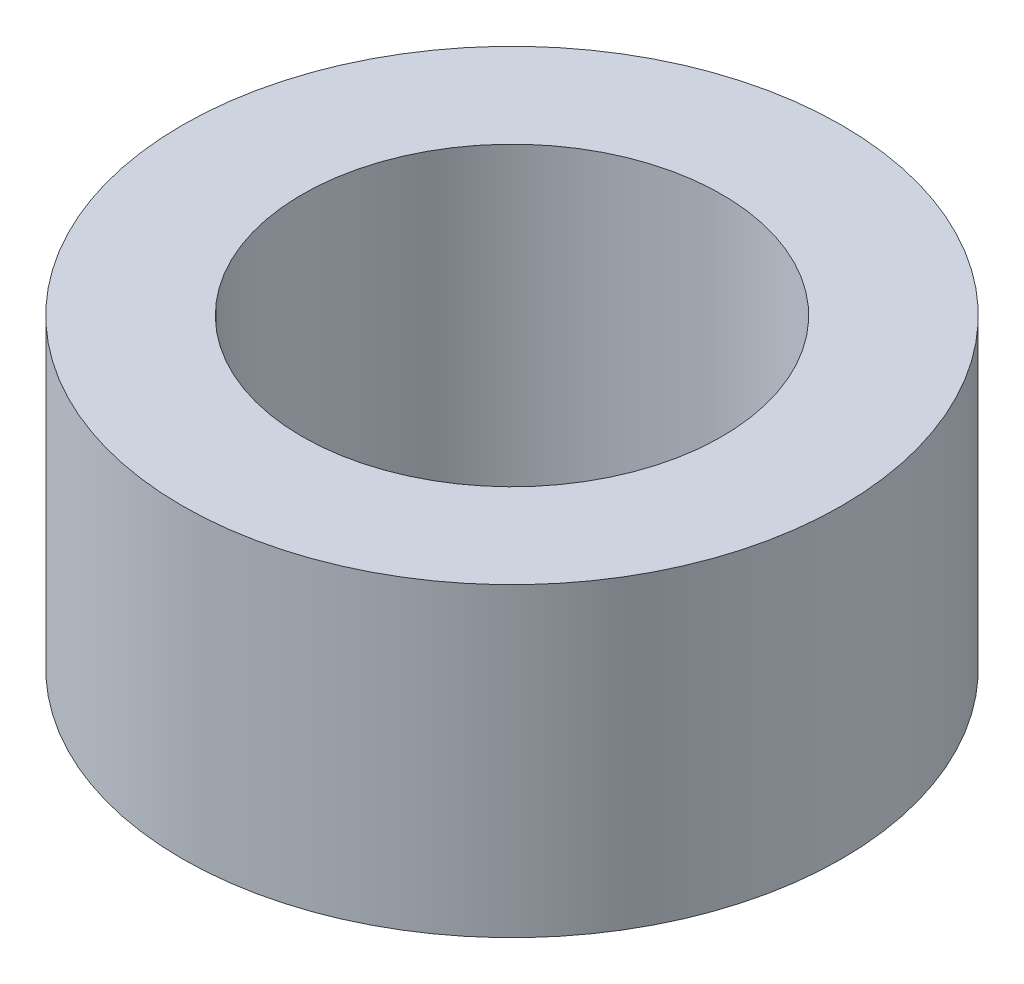
from build123d import *

# Parameters (mm, degrees)
SKETCH_1_R      = 5.5
SKETCH_1_R_2    = 3.5
EXTRUDE_1_DEPTH = 5.1


with BuildPart() as part:
    # 草图1 → 凸台-拉伸1 (new body)
    with BuildSketch(Plane(origin=(0, 0, 0), x_dir=(1, 0, 0), z_dir=(0, 1, 0))):
        with Locations(Location((0, 0, 0), (0, 0, 270))):
            Circle(SKETCH_1_R)
        with Locations(Location((0, 0, 0), (0, 0, 270))):
            Circle(SKETCH_1_R_2, mode=Mode.SUBTRACT)
    extrude(amount=EXTRUDE_1_DEPTH)


solid = part.part
